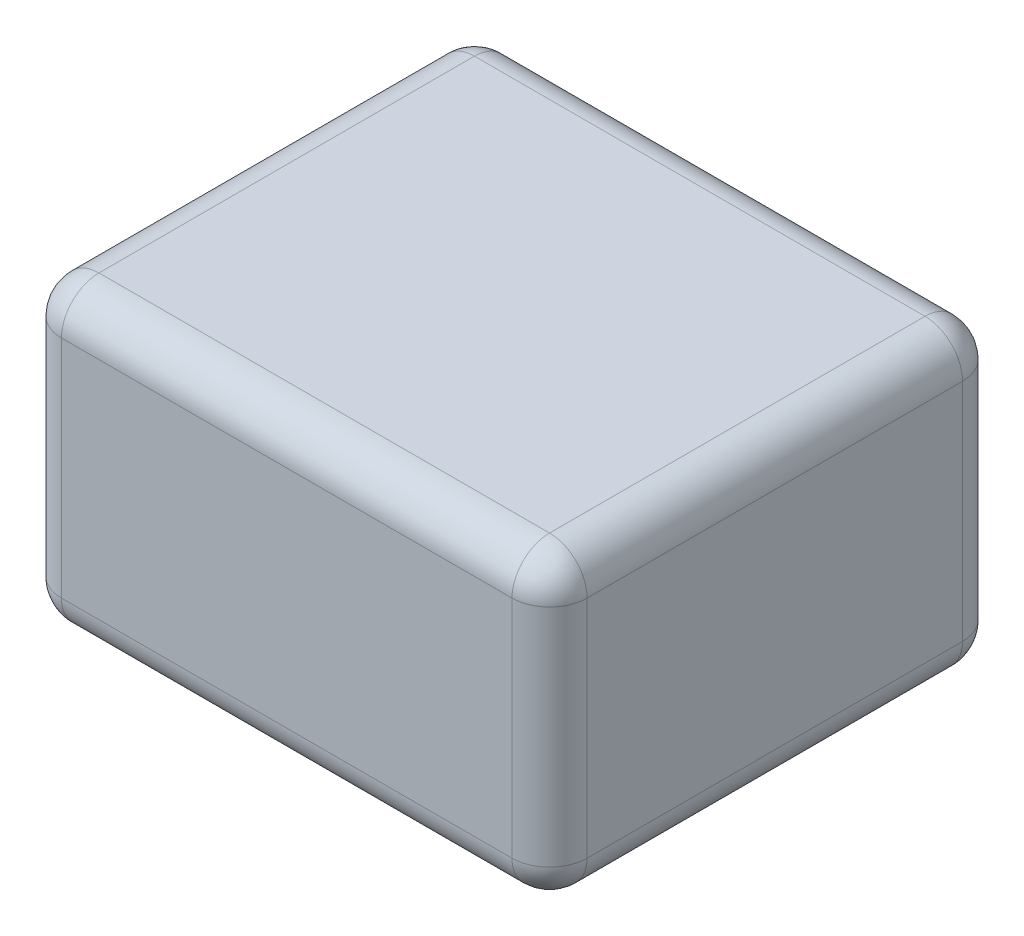
from build123d import *

# Parameters (mm, degrees)
SKETCH1_W           = 70
SKETCH1_H           = 60
BOSS_EXTRUDE1_DEPTH = 40
FILLET1_R           = 5


with BuildPart() as part:
    # Sketch1 → Boss-Extrude1 (new body)
    with BuildSketch(Plane(origin=(0, 0, 0), x_dir=(1, 0, 0), z_dir=(0, 1, 0))):
        Rectangle(SKETCH1_W, SKETCH1_H)
    extrude(amount=BOSS_EXTRUDE1_DEPTH)

    # Fillet1
    fillet1_edges = [part.edges().sort_by_distance(p)[0] for p in [
        (-35, 40, 0),
        (0, 40, 30),
        (35, 40, 0),
        (0, 0, 30),
        (-35, 0, 0),
        (0, 0, -30),
        (35, 0, 0),
        (35, 20, 30),
        (-35, 20, 30),
        (-35, 20, -30),
        (35, 20, -30),
        (0, 40, -30),
    ]]
    fillet(fillet1_edges, radius=FILLET1_R)


solid = part.part
